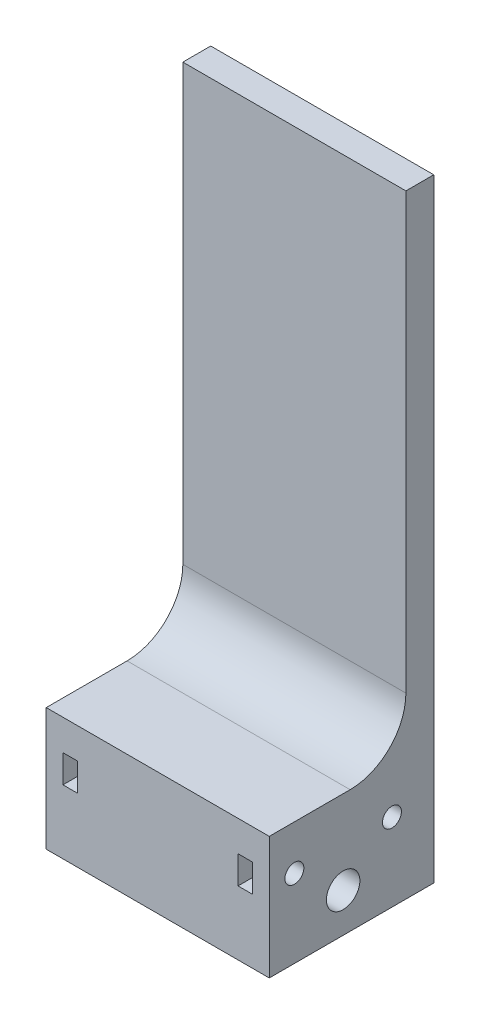
from build123d import *

# Parameters (mm, degrees)
SKETCH1_R           = 3
SKETCH1_R_2         = 1.7
BOSS_EXTRUDE1_DEPTH = 40
FILLET1_R           = 10
SKETCH2_W           = 2.6
SKETCH2_H           = 5
CUT_EXTRUDE1_DEPTH  = 7
SKETCH3_W           = 2.6
SKETCH3_H           = 5
CUT_EXTRUDE2_DEPTH  = 11


with BuildPart() as part:
    # Sketch1 → Boss-Extrude1 (new body)
    with BuildSketch(Plane.ZY.offset(-20)):
        Polygon((2, 17), (-27.5, 17), (-27.5, 127), (-22.5, 127), (-22.5, 39), (2, 39), align=None)
        with Locations(Location((-11.25, 24, 0), (0, 0, 90))):
            Circle(SKETCH1_R, mode=Mode.SUBTRACT)
        with Locations(Location((-2.5, 31, 0), (0, 0, 90))):
            Circle(SKETCH1_R_2, mode=Mode.SUBTRACT)
        with Locations(Location((-20, 31, 0), (0, 0, 90))):
            Circle(SKETCH1_R_2, mode=Mode.SUBTRACT)
    extrude(amount=BOSS_EXTRUDE1_DEPTH)

    # Fillet1
    fillet1_edges = [part.edges().sort_by_distance(p)[0] for p in [
        (0, 39, -22.5),
    ]]
    fillet(fillet1_edges, radius=FILLET1_R)

    # Sketch2 → Cut-Extrude1 (cut)
    with BuildSketch(Plane.XY.offset(2)):
        with Locations((15.7, 31)):
            Rectangle(SKETCH2_W, SKETCH2_H)
        with Locations((-15.7, 31)):
            Rectangle(SKETCH2_W, SKETCH2_H)
    extrude(amount=-CUT_EXTRUDE1_DEPTH, mode=Mode.SUBTRACT)

    # Sketch3 → Cut-Extrude2 (cut)
    with BuildSketch(Plane(origin=(0, 0, -27.5), x_dir=(-1, 0, 0), z_dir=(0, 0, -1))):
        with Locations((15.7, 31)):
            Rectangle(SKETCH3_W, SKETCH3_H)
        with Locations((-15.7, 31)):
            Rectangle(SKETCH3_W, SKETCH3_H)
    extrude(amount=-CUT_EXTRUDE2_DEPTH, mode=Mode.SUBTRACT)


solid = part.part
